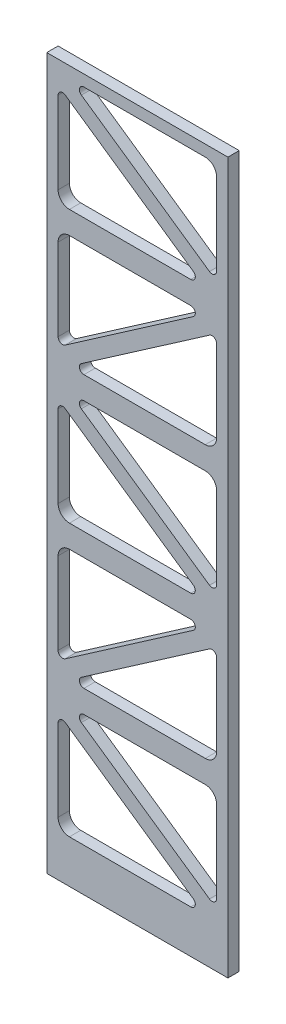
from build123d import *

# Parameters (mm, degrees)
MODEL_W             = 101.6
MODEL_H             = 398.78
BOSS_EXTRUDE1_DEPTH = 6.35


with BuildPart() as part:
    # Model → Boss-Extrude1 (new body)
    with BuildSketch(Plane.XY):
        with Locations((50.8, 199.39)):
            Rectangle(MODEL_W, MODEL_H)
        with BuildLine():
            Line((88.9, 87.63), (20.83121403, 87.63))
            ThreePointArc((20.83121403, 87.63), (18.406749642, 85.847345646), (19.385420684, 83.001631833))
            Line((19.385420684, 83.001631833), (91.264206654, 33.239395393))
            ThreePointArc((91.264206654, 33.239395393), (93.888830968, 33.077884107), (95.25, 35.32776356))
            Line((95.25, 35.32776356), (95.25, 81.28))
            ThreePointArc((95.25, 81.28), (93.390128061, 85.770128061), (88.9, 87.63))
        make_face(mode=Mode.SUBTRACT)
        with BuildLine():
            Line((6.35, 157.48), (6.35, 111.52776356))
            ThreePointArc((6.35, 111.52776356), (7.711169032, 109.277884107), (10.335793346, 109.439395393))
            Line((10.335793346, 109.439395393), (82.214579316, 159.201631833))
            ThreePointArc((82.214579316, 159.201631833), (83.193250358, 162.047345646), (80.76878597, 163.83))
            Line((80.76878597, 163.83), (12.7, 163.83))
            ThreePointArc((12.7, 163.83), (8.209871939, 161.970128061), (6.35, 157.48))
        make_face(mode=Mode.SUBTRACT)
        with BuildLine():
            Line((88.9, 240.03), (20.83121403, 240.03))
            ThreePointArc((20.83121403, 240.03), (18.406749642, 238.247345646), (19.385420684, 235.401631833))
            Line((19.385420684, 235.401631833), (91.264206654, 185.639395393))
            ThreePointArc((91.264206654, 185.639395393), (93.888830968, 185.477884107), (95.25, 187.72776356))
            Line((95.25, 187.72776356), (95.25, 233.68))
            ThreePointArc((95.25, 233.68), (93.390128061, 238.170128061), (88.9, 240.03))
        make_face(mode=Mode.SUBTRACT)
        with BuildLine():
            Line((12.7, 176.53), (80.76878597, 176.53))
            ThreePointArc((80.76878597, 176.53), (83.193250358, 178.312654354), (82.214579316, 181.158368167))
            Line((82.214579316, 181.158368167), (10.335793346, 230.920604607))
            ThreePointArc((10.335793346, 230.920604607), (7.711169032, 231.082115893), (6.35, 228.83223644))
            Line((6.35, 228.83223644), (6.35, 182.88))
            ThreePointArc((6.35, 182.88), (8.209871939, 178.389871939), (12.7, 176.53))
        make_face(mode=Mode.SUBTRACT)
        with BuildLine():
            Line((91.264206654, 154.720604607), (19.385420684, 104.958368167))
            ThreePointArc((19.385420684, 104.958368167), (18.406749642, 102.112654354), (20.83121403, 100.33))
            Line((20.83121403, 100.33), (88.9, 100.33))
            ThreePointArc((88.9, 100.33), (93.390128061, 102.189871939), (95.25, 106.68))
            Line((95.25, 106.68), (95.25, 152.63223644))
            ThreePointArc((95.25, 152.63223644), (93.888830968, 154.882115893), (91.264206654, 154.720604607))
        make_face(mode=Mode.SUBTRACT)
        with BuildLine():
            Line((6.35, 309.88), (6.35, 263.92776356))
            ThreePointArc((6.35, 263.92776356), (7.711169032, 261.677884107), (10.335793346, 261.839395393))
            Line((10.335793346, 261.839395393), (82.214579316, 311.601631833))
            ThreePointArc((82.214579316, 311.601631833), (83.193250358, 314.447345646), (80.76878597, 316.23))
            Line((80.76878597, 316.23), (12.7, 316.23))
            ThreePointArc((12.7, 316.23), (8.209871939, 314.370128061), (6.35, 309.88))
        make_face(mode=Mode.SUBTRACT)
        with BuildLine():
            Line((88.9, 392.43), (20.83121403, 392.43))
            ThreePointArc((20.83121403, 392.43), (18.406749642, 390.647345646), (19.385420684, 387.801631833))
            Line((19.385420684, 387.801631833), (91.264206654, 338.039395393))
            ThreePointArc((91.264206654, 338.039395393), (93.888830968, 337.877884107), (95.25, 340.12776356))
            Line((95.25, 340.12776356), (95.25, 386.08))
            ThreePointArc((95.25, 386.08), (93.390128061, 390.570128061), (88.9, 392.43))
        make_face(mode=Mode.SUBTRACT)
        with BuildLine():
            Line((12.7, 328.93), (80.76878597, 328.93))
            ThreePointArc((80.76878597, 328.93), (83.193250358, 330.712654354), (82.214579316, 333.558368167))
            Line((82.214579316, 333.558368167), (10.335793346, 383.320604607))
            ThreePointArc((10.335793346, 383.320604607), (7.711169032, 383.482115893), (6.35, 381.23223644))
            Line((6.35, 381.23223644), (6.35, 335.28))
            ThreePointArc((6.35, 335.28), (8.209871939, 330.789871939), (12.7, 328.93))
        make_face(mode=Mode.SUBTRACT)
        with BuildLine():
            Line((12.7, 24.13), (80.76878597, 24.13))
            ThreePointArc((80.76878597, 24.13), (83.193250358, 25.912654354), (82.214579316, 28.758368167))
            Line((82.214579316, 28.758368167), (10.335793346, 78.520604607))
            ThreePointArc((10.335793346, 78.520604607), (7.711169032, 78.682115893), (6.35, 76.43223644))
            Line((6.35, 76.43223644), (6.35, 30.48))
            ThreePointArc((6.35, 30.48), (8.209871939, 25.989871939), (12.7, 24.13))
        make_face(mode=Mode.SUBTRACT)
        with BuildLine():
            Line((91.264206654, 307.120604607), (19.385420684, 257.358368167))
            ThreePointArc((19.385420684, 257.358368167), (18.406749642, 254.512654354), (20.83121403, 252.73))
            Line((20.83121403, 252.73), (88.9, 252.73))
            ThreePointArc((88.9, 252.73), (93.390128061, 254.589871939), (95.25, 259.08))
            Line((95.25, 259.08), (95.25, 305.03223644))
            ThreePointArc((95.25, 305.03223644), (93.888830968, 307.282115893), (91.264206654, 307.120604607))
        make_face(mode=Mode.SUBTRACT)
    extrude(amount=BOSS_EXTRUDE1_DEPTH)


solid = part.part
